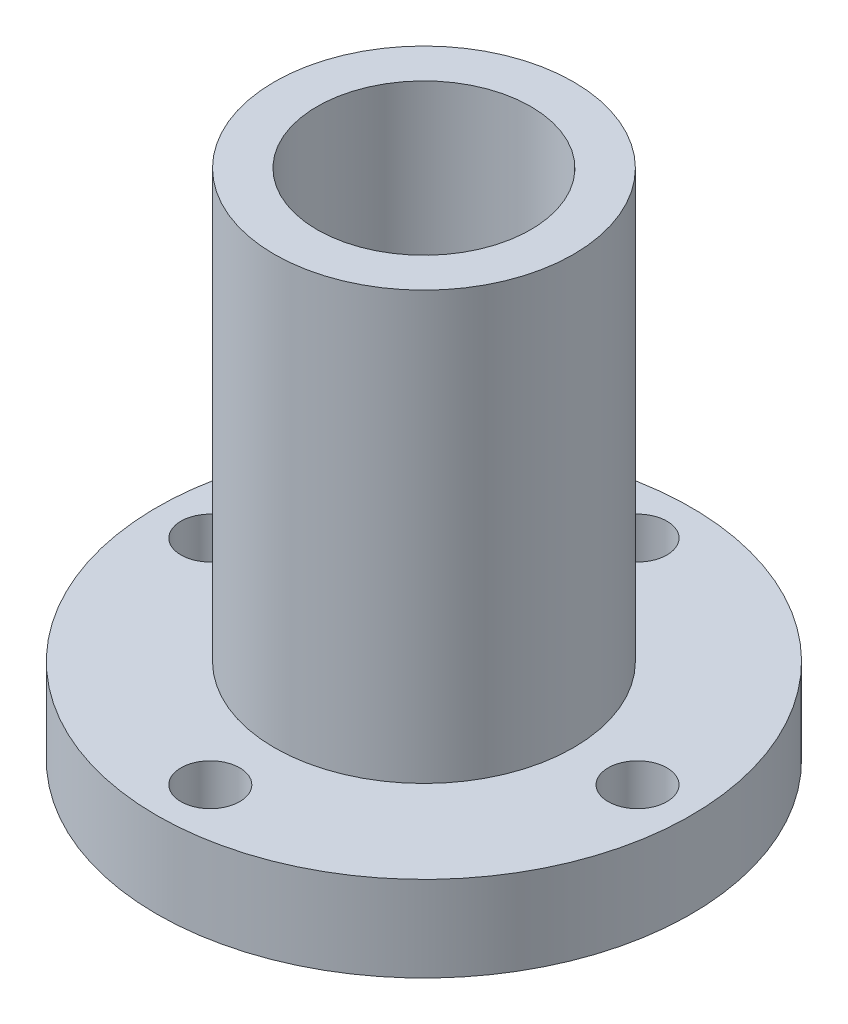
from build123d import *

# Parameters (mm, degrees)
ESQUISSE1_R                  = 25
BOSS_EXTRU_1_DEPTH           = 8
ESQUISSE2_R                  = 14
BOSS_EXTRU_2_DEPTH           = 40
ENL_V_MAT_EXTRU_1_DEPTH      = 60.615434243
ENL_V_MAT_EXTRU_1_DEPTH_BACK = 60.615434243
ESQUISSE3_R                  = 10
ENL_V_MAT_EXTRU_2_DEPTH      = 54.38539126
ENL_V_MAT_EXTRU_2_DEPTH_BACK = 54.38539126
ESQUISSE4_R                  = 2.75


with BuildPart() as part:
    # Esquisse1 → Boss.-Extru.1 (new body)
    with BuildSketch(Plane(origin=(0, 0, 0), x_dir=(1, 0, 0), z_dir=(0, 1, 0))):
        with Locations(Location((0, 0, 0), (0, 0, 270))):
            Circle(ESQUISSE1_R)
    extrude(amount=BOSS_EXTRU_1_DEPTH)

    # Esquisse2 → Boss.-Extru.2 (add)
    with BuildSketch(Plane(origin=(0, 8, 0), x_dir=(1, 0, 0), z_dir=(0, 1, 0))):
        with Locations(Location((0, 0, 0), (0, 0, 270))):
            Circle(ESQUISSE2_R)
    extrude(amount=BOSS_EXTRU_2_DEPTH)

    # Esquisse3 → Enlèv. mat.-Extru.1 (cut, two sides: drawn at the far end of the back side and taken through both)
    with BuildSketch(Plane(origin=(0, 48, 0), x_dir=(1, 0, 0), z_dir=(0, 1, 0)).offset(-ENL_V_MAT_EXTRU_1_DEPTH_BACK)):
        with Locations(Location((0, 0, 0), (0, 0, 270))):
            Circle(ESQUISSE3_R)
    extrude(amount=ENL_V_MAT_EXTRU_1_DEPTH + ENL_V_MAT_EXTRU_1_DEPTH_BACK, mode=Mode.SUBTRACT)

    # Esquisse4 → Enlèv. mat.-Extru.2 (cut, two sides: drawn at the far end of the back side and taken through both)
    with BuildSketch(Plane(origin=(0, 8, 0), x_dir=(1, 0, 0), z_dir=(0, 1, 0)).offset(-ENL_V_MAT_EXTRU_2_DEPTH_BACK)):
        with Locations(Location((0, 20, 0), (0, 0, 270))):
            Circle(ESQUISSE4_R)
        with Locations(Location((20, 0, 0), (0, 0, 270))):
            Circle(ESQUISSE4_R)
        with Locations(Location((0, -20, 0), (0, 0, 270))):
            Circle(ESQUISSE4_R)
        with Locations(Location((-20, 0, 0), (0, 0, 270))):
            Circle(ESQUISSE4_R)
    extrude(amount=ENL_V_MAT_EXTRU_2_DEPTH + ENL_V_MAT_EXTRU_2_DEPTH_BACK, mode=Mode.SUBTRACT)


solid = part.part
